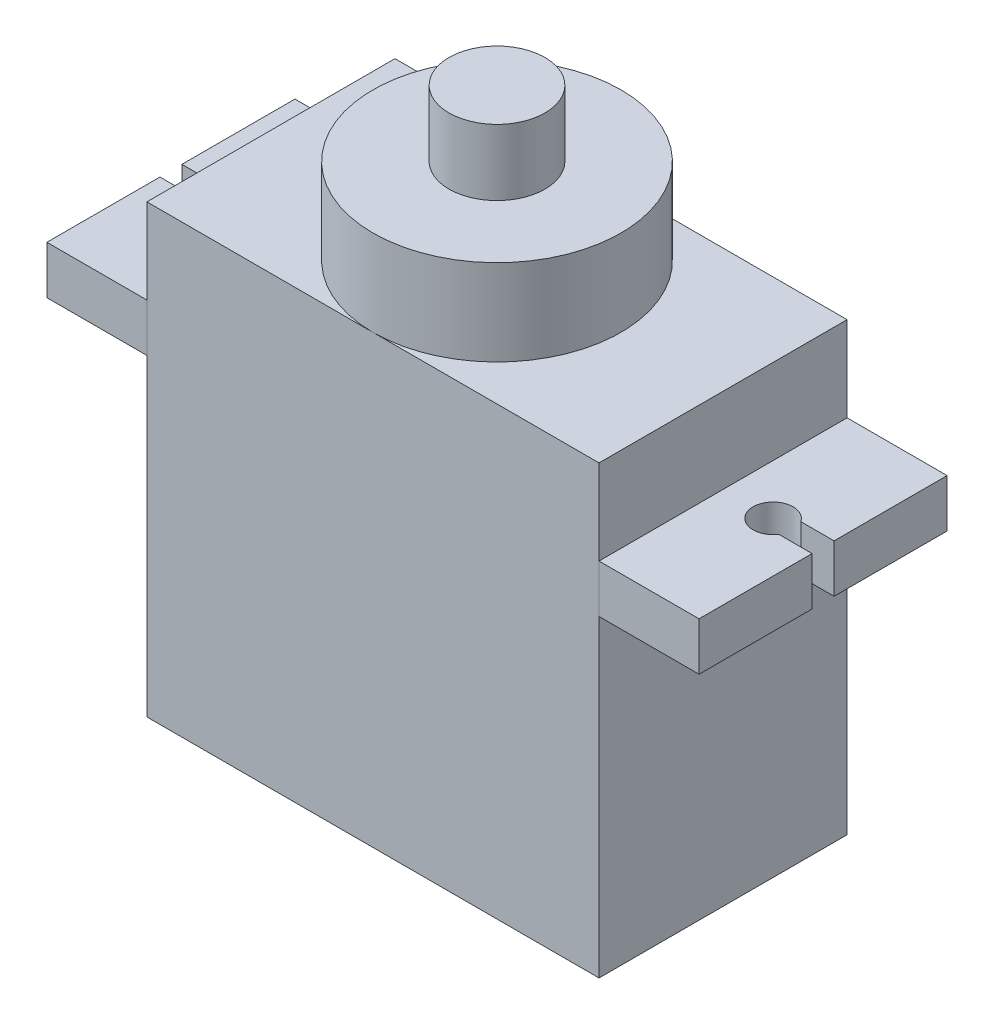
from build123d import *

# Parameters (mm, degrees)
SKETCH_1_W          = 22.6
SKETCH_1_H          = 12.4
EXTRUDE_1_DEPTH     = 22.3
SKETCH_2_W          = 5
SKETCH_2_H          = 2.4
EXTRUDE_2_DEPTH     = 12.4
EXTRUDE_2_2_DEPTH   = 12.4
CUT_EXTRUDE_1_DEPTH = 26.098456128
SKETCH_4_R          = 6.2
EXTRUDE_3_DEPTH     = 4.3
SKETCH_5_R          = 2.4
EXTRUDE_4_DEPTH     = 3.3


with BuildPart() as part:
    # 草图1 → 凸台-拉伸1 (new body)
    with BuildSketch(Plane(origin=(0, 0, 0), x_dir=(1, 0, 0), z_dir=(0, 1, 0))):
        Rectangle(SKETCH_1_W, SKETCH_1_H)
    extrude(amount=EXTRUDE_1_DEPTH)

    # 草图4 → 凸台-拉伸3 (add)
    with BuildSketch(Plane(origin=(0, 22.3, 0), x_dir=(1, 0, 0), z_dir=(0, 1, 0))):
        with Locations(Location((0, 0, 0), (0, 0, 270))):
            Circle(SKETCH_4_R)
    extrude(amount=EXTRUDE_3_DEPTH)

    # 草图5 → 凸台-拉伸4 (add)
    with BuildSketch(Plane(origin=(0, 26.6, 0), x_dir=(1, 0, 0), z_dir=(0, 1, 0))):
        with Locations(Location((0, 0, 0), (0, 0, 270))):
            Circle(SKETCH_5_R)
    extrude(amount=EXTRUDE_4_DEPTH)


with BuildPart() as body_2:
    # 草图2 → 凸台-拉伸2 (new, through all)
    with BuildSketch(Plane.XY.offset(6.2)):
        with Locations((13.8, 16.85)):
            Rectangle(SKETCH_2_W, SKETCH_2_H)
    extrude(amount=-EXTRUDE_2_DEPTH)


with BuildPart() as body_3:
    # 草图2 → Extrude 2 2 (new, through all)
    with BuildSketch(Plane.XY.offset(6.2)):
        with Locations((-13.8, 16.85)):
            Rectangle(SKETCH_2_W, SKETCH_2_H)
    extrude(amount=-EXTRUDE_2_2_DEPTH)


with BuildPart() as cut_extrude_1_tool:
    # 草图3 → 切除-拉伸1 (new, through all)
    with BuildSketch(Plane(origin=(0, 18.05, 0), x_dir=(1, 0, 0), z_dir=(0, 1, 0))):
        with BuildLine():
            Line((14.635164654, 0.55), (16.3, 0.55))
            Line((16.3, 0.55), (16.3, -0.55))
            Line((16.3, -0.55), (14.635164654, -0.55))
            ThreePointArc((14.635164654, -0.55), (12.8, 0), (14.635164654, 0.55))
        make_face()
        with BuildLine():
            Line((-14.635164654, -0.55), (-16.3, -0.55))
            Line((-16.3, -0.55), (-16.3, 0.55))
            Line((-16.3, 0.55), (-14.635164654, 0.55))
            ThreePointArc((-14.635164654, 0.55), (-12.8, 0), (-14.635164654, -0.55))
        make_face()
    extrude(amount=-CUT_EXTRUDE_1_DEPTH)


with BuildPart() as body_2_1:
    add(body_2.part)

    # 切除-拉伸1: cut by cut_extrude_1_tool
    add(cut_extrude_1_tool.part, mode=Mode.SUBTRACT)


with BuildPart() as body_3_1:
    add(body_3.part)

    # 切除-拉伸1: cut by cut_extrude_1_tool
    add(cut_extrude_1_tool.part, mode=Mode.SUBTRACT)


solid = Compound([part.part, body_2_1.part, body_3_1.part])
